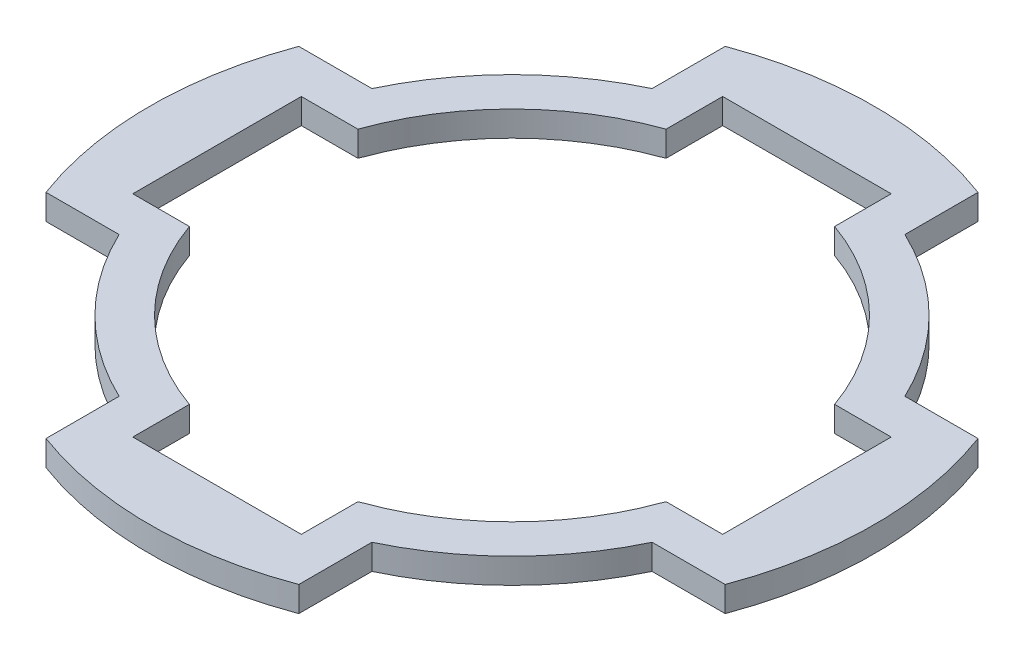
from build123d import *

# Parameters (mm, degrees)
BOSS_EXTRUDE1_DEPTH = 0.3


with BuildPart() as part:
    # Sketch1 → Boss-Extrude1 (new body)
    with BuildSketch(Plane(origin=(0, 0, 0), x_dir=(1, 0, 0), z_dir=(0, 1, 0))):
        with BuildLine():
            Line((-4.029888336, 1.5), (-3.16227766, 1.5))
            ThreePointArc((-3.16227766, 1.5), (-2.474873734, 2.474873734), (-1.5, 3.16227766))
            Line((-1.5, 3.16227766), (-1.5, 4.029888336))
            ThreePointArc((-1.5, 4.029888336), (0, 4.3), (1.5, 4.029888336))
            Line((1.5, 4.029888336), (1.5, 3.16227766))
            ThreePointArc((1.5, 3.16227766), (2.474873734, 2.474873734), (3.16227766, 1.5))
            Line((3.16227766, 1.5), (4.029888336, 1.5))
            ThreePointArc((4.029888336, 1.5), (4.3, 0), (4.029888336, -1.5))
            Line((4.029888336, -1.5), (3.16227766, -1.5))
            ThreePointArc((3.16227766, -1.5), (2.474873734, -2.474873734), (1.5, -3.16227766))
            Line((1.5, -3.16227766), (1.5, -4.029888336))
            ThreePointArc((1.5, -4.029888336), (0, -4.3), (-1.5, -4.029888336))
            Line((-1.5, -4.029888336), (-1.5, -3.16227766))
            ThreePointArc((-1.5, -3.16227766), (-2.474873734, -2.474873734), (-3.16227766, -1.5))
            Line((-3.16227766, -1.5), (-4.029888336, -1.5))
            ThreePointArc((-4.029888336, -1.5), (-4.3, 0), (-4.029888336, 1.5))
        make_face()
        with BuildLine():
            Line((-3.5, 1), (-2.828427125, 1))
            ThreePointArc((-2.828427125, 1), (-2.121320344, 2.121320344), (-1, 2.828427125))
            Line((-1, 2.828427125), (-1, 3.5))
            Line((-1, 3.5), (1, 3.5))
            Line((1, 3.5), (1, 2.828427125))
            ThreePointArc((1, 2.828427125), (2.121320344, 2.121320344), (2.828427125, 1))
            Line((2.828427125, 1), (3.5, 1))
            Line((3.5, 1), (3.5, -1))
            Line((3.5, -1), (2.828427125, -1))
            ThreePointArc((2.828427125, -1), (2.121320344, -2.121320344), (1, -2.828427125))
            Line((1, -2.828427125), (1, -3.5))
            Line((1, -3.5), (-1, -3.5))
            Line((-1, -3.5), (-1, -2.828427125))
            ThreePointArc((-1, -2.828427125), (-2.121320344, -2.121320344), (-2.828427125, -1))
            Line((-2.828427125, -1), (-3.5, -1))
            Line((-3.5, -1), (-3.5, 1))
        make_face(mode=Mode.SUBTRACT)
    extrude(amount=BOSS_EXTRUDE1_DEPTH)


solid = part.part
